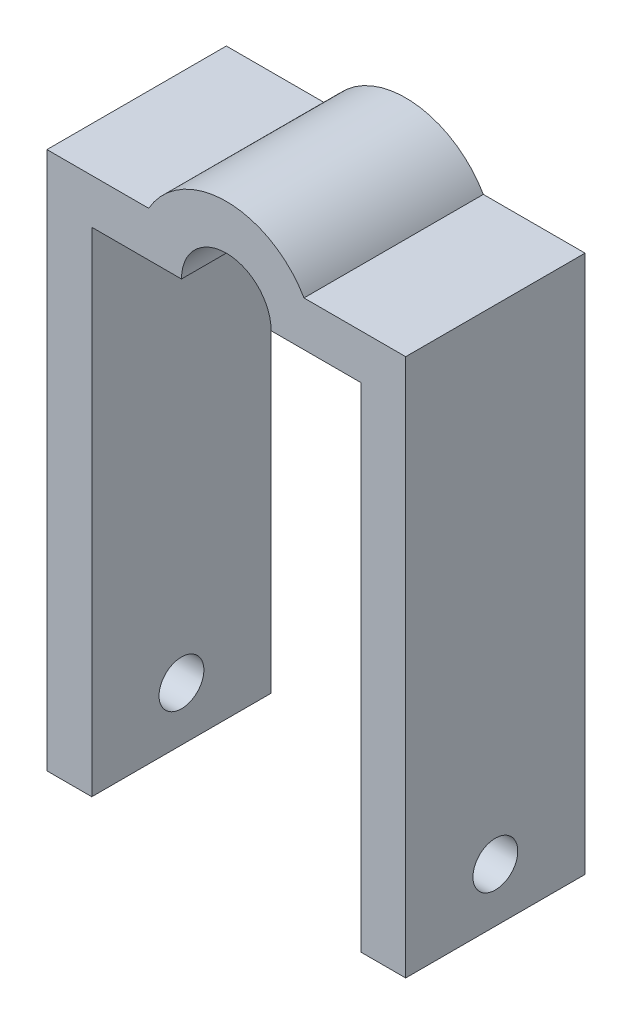
from build123d import *

# Parameters (mm, degrees)
BOSS_EXTRUDE1_DEPTH = 12.7
SKETCH2_R           = 1.5875
CUT_EXTRUDE1_DEPTH  = 76.2


with BuildPart() as part:
    # Sketch1 → Boss-Extrude1 (new body)
    with BuildSketch(Plane.XY):
        with BuildLine():
            Line((0, 0), (0, 34.925))
            Line((0, 34.925), (6.35, 34.925))
            ThreePointArc((6.35, 34.925), (9.525, 38.1), (12.7, 34.925))
            Line((12.7, 34.925), (19.05, 34.925))
            Line((19.05, 34.925), (19.05, 0))
            Line((19.05, 0), (22.225, 0))
            Line((22.225, 0), (22.225, 38.1))
            Line((22.225, 38.1), (15.024261314, 38.1))
            ThreePointArc((15.024261314, 38.1), (9.525, 41.275), (4.025738686, 38.1))
            Line((4.025738686, 38.1), (-3.175, 38.1))
            Line((-3.175, 38.1), (-3.175, 0))
            Line((-3.175, 0), (0, 0))
        make_face()
    extrude(amount=BOSS_EXTRUDE1_DEPTH)

    # Sketch2 → Cut-Extrude1 (cut)
    with BuildSketch(Plane.ZY.offset(3.175)):
        with Locations((6.35, 3.81)):
            Circle(SKETCH2_R)
    extrude(amount=-CUT_EXTRUDE1_DEPTH, mode=Mode.SUBTRACT)


solid = part.part
